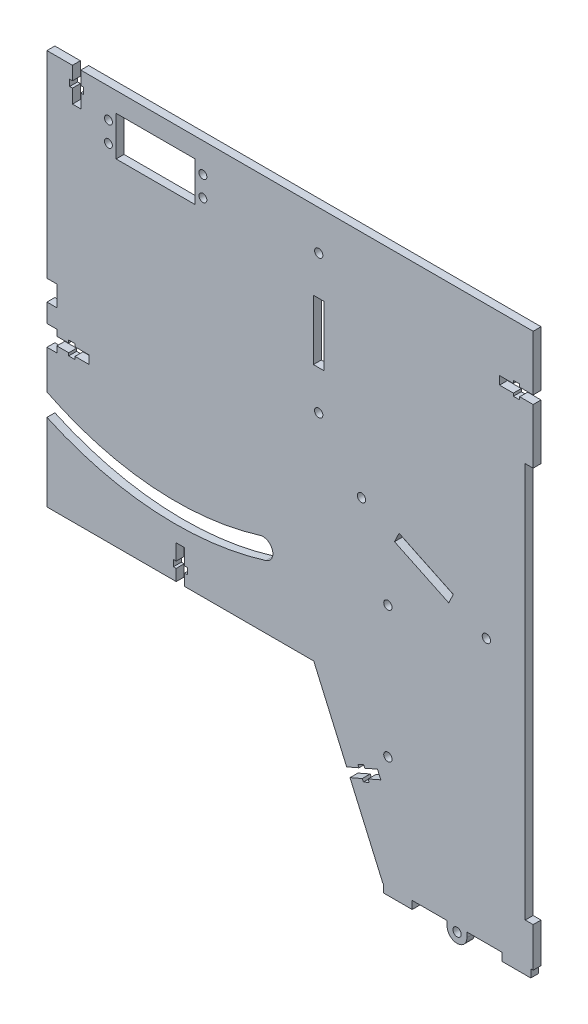
from build123d import *

# Parameters (mm, degrees)
BOSS_EXTRU_1_DEPTH       = 4
ENL_V_MAT_EXTRU_3_DEPTH  = 10
ESQUISSE3_R              = 2
ESQUISSE3_W              = 40
ESQUISSE3_H              = 20
ENL_V_MAT_EXTRU_4_DEPTH  = 242.33172191
ESQUISSE4_W              = 4
ESQUISSE4_H              = 200
ENL_V_MAT_EXTRU_5_DEPTH  = 242.33172191
ESQUISSE5_R              = 2.1
ENL_V_MAT_EXTRU_6_DEPTH  = 242.33172191
ESQUISSE8_W              = 5.4
ESQUISSE8_H              = 30.4
ENL_V_MAT_EXTRU_8_DEPTH  = 242.33172191
ESQUISSE10_W             = 4.4
ESQUISSE10_H             = 10.4
ENL_V_MAT_EXTRU_9_DEPTH  = 5
ESQUISSE12_R             = 2.1
BOSS_EXTRU_2_DEPTH       = 4
ESQUISSE14_W             = 14.6
ESQUISSE14_H             = 4
BOSS_EXTRU_3_DEPTH       = 4
ENL_V_MAT_EXTRU_11_DEPTH = 242.33172191
ENL_V_MAT_EXTRU_12_DEPTH = 242.33172191
ENL_V_MAT_EXTRU_13_DEPTH = 242.33172191
ENL_V_MAT_EXTRU_14_DEPTH = 242.33172191
ESQUISSE19_R             = 2.1
ENL_V_MAT_EXTRU_15_DEPTH = 242.33172191
ENL_V_MAT_EXTRU_16_DEPTH = 242.33172191


with BuildPart() as part:
    # Esquisse1 → Boss.-Extru.1 (new body)
    with BuildSketch(Plane.XY):
        Polygon((0, 0), (-135, 0), (-135, 200), (111, 200), (111, -80), (35, -80), align=None)
    extrude(amount=BOSS_EXTRU_1_DEPTH)

    # Esquisse2 → Enlèv. mat.-Extru.3 (cut)
    with BuildSketch(Plane(origin=(-100, 38, 4), x_dir=(-1, 0, 0), z_dir=(0, 0, -1))):
        with BuildLine():
            ThreePointArc((-75.787868531, -6.082649542), (-15.633697972, -12.332787722), (42.333333333, 4.912841999))
            ThreePointArc((42.333333333, 4.912841999), (44.422166387, 11.668341719), (37.666666667, 13.757174773))
            ThreePointArc((37.666666667, 13.757174773), (-16.560556167, -2.375833675), (-72.833812496, 3.471069783))
            ThreePointArc((-72.833812496, 3.471069783), (-79.087700176, 0.171238138), (-75.787868531, -6.082649542))
        make_face()
    extrude(amount=ENL_V_MAT_EXTRU_3_DEPTH, mode=Mode.SUBTRACT)

    # Esquisse3 → Enlèv. mat.-Extru.4 (cut, through all)
    with BuildSketch(Plane.XY.offset(4)):
        with Locations((-103.9, 185.1)):
            Circle(ESQUISSE3_R)
        with Locations((-103.9, 174.9)):
            Circle(ESQUISSE3_R)
        with Locations((-56.1, 185.1)):
            Circle(ESQUISSE3_R)
        with Locations((-56.1, 174.9)):
            Circle(ESQUISSE3_R)
        with Locations((-80, 180)):
            Rectangle(ESQUISSE3_W, ESQUISSE3_H)
    extrude(amount=-ENL_V_MAT_EXTRU_4_DEPTH, mode=Mode.SUBTRACT)

    # Esquisse4 → Enlèv. mat.-Extru.5 (cut, through all)
    with BuildSketch(Plane(origin=(0, 0, 0), x_dir=(-1, 0, 0), z_dir=(0, 0, -1))):
        with Locations((-109, 40)):
            Rectangle(ESQUISSE4_W, ESQUISSE4_H)
    extrude(amount=-ENL_V_MAT_EXTRU_5_DEPTH, mode=Mode.SUBTRACT)

    # Esquisse5 → Enlèv. mat.-Extru.6 (cut, through all)
    with BuildSketch(Plane(origin=(0, 0, 0), x_dir=(-1, 0, 0), z_dir=(0, 0, -1))):
        with Locations((-2.5, 180)):
            Circle(ESQUISSE5_R)
        with Locations((-2.5, 110)):
            Circle(ESQUISSE5_R)
        with Locations((-24.132044328, 83.658479689)):
            Circle(ESQUISSE5_R)
        with Locations((-87.332280645, 53.563129062)):
            Circle(ESQUISSE5_R)
    extrude(amount=-ENL_V_MAT_EXTRU_6_DEPTH, mode=Mode.SUBTRACT)

    # Esquisse8 → Enlèv. mat.-Extru.8 (cut, through all)
    with BuildSketch(Plane(origin=(0, 0, 0), x_dir=(-1, 0, 0), z_dir=(0, 0, -1))):
        Polygon((-40.847861933, 72.708071397), (-43.169503267, 77.583518198), (-70.616463039, 64.513537354), (-68.294821705, 59.638090553), align=None)
        with Locations((-2.5, 145)):
            Rectangle(ESQUISSE8_W, ESQUISSE8_H)
    extrude(amount=-ENL_V_MAT_EXTRU_8_DEPTH, mode=Mode.SUBTRACT)

    # Esquisse10 → Enlèv. mat.-Extru.9 (cut)
    with BuildSketch(Plane.ZY.offset(135)):
        with Locations((2, 95)):
            Rectangle(ESQUISSE10_W, ESQUISSE10_H)
        with Locations((2, 75.192593016)):
            Rectangle(ESQUISSE10_W, ESQUISSE10_H)
    extrude(amount=-ENL_V_MAT_EXTRU_9_DEPTH, mode=Mode.SUBTRACT)

    # Esquisse12 → Boss.-Extru.2 (add)
    with BuildSketch(Plane.XY.offset(4)):
        with BuildLine():
            Line((67.5, -80), (67.5, -82.5))
            ThreePointArc((67.5, -82.5), (72.5, -87.5), (77.5, -82.5))
            Line((77.5, -82.5), (77.5, -80))
            Line((77.5, -80), (67.5, -80))
        make_face()
        with Locations((72.5, -82.5)):
            Circle(ESQUISSE12_R, mode=Mode.SUBTRACT)
    extrude(amount=-BOSS_EXTRU_2_DEPTH)

    # Esquisse14 → Boss.-Extru.3 (add)
    with BuildSketch(Plane(origin=(0, 0, 0), x_dir=(-1, 0, 0), z_dir=(0, 0, -1))):
        with Locations((-102.5, -82)):
            Rectangle(ESQUISSE14_W, ESQUISSE14_H)
        with Locations((-42.5, -82)):
            Rectangle(ESQUISSE14_W, ESQUISSE14_H)
    extrude(amount=-BOSS_EXTRU_3_DEPTH)

    # Esquisse15 → Enlèv. mat.-Extru.11 (cut, through all)
    with BuildSketch(Plane(origin=(0, 0, 0), x_dir=(-1, 0, 0), z_dir=(0, 0, -1))):
        Polygon((-18.341719551, -41.923930403), (-16.658280449, -38.076069597), (-22.888150326, -35.350501525), (-22.327003958, -34.067881257), (-25.25870743, -32.785260988), (-25.819853798, -34.067881257), (-32.232955142, -31.262149418), (-33.916394245, -35.110010225), (-27.5032929, -37.915742063), (-28.064439268, -39.198362332), (-25.132735796, -40.480982601), (-24.571589429, -39.198362332), align=None)
    extrude(amount=-ENL_V_MAT_EXTRU_11_DEPTH, mode=Mode.SUBTRACT)

    # Esquisse16 → Enlèv. mat.-Extru.12 (cut, through all)
    with BuildSketch(Plane(origin=(0, 0, 0), x_dir=(-1, 0, 0), z_dir=(0, 0, -1))):
        Polygon((-111, 167.9), (-111, 172.1), (-104.2, 172.1), (-104.2, 173.5), (-101, 173.5), (-101, 172.1), (-94, 172.1), (-94, 167.9), (-101, 167.9), (-101, 166.5), (-104.2, 166.5), (-104.2, 167.9), align=None)
    extrude(amount=-ENL_V_MAT_EXTRU_12_DEPTH, mode=Mode.SUBTRACT)

    # Esquisse17 → Enlèv. mat.-Extru.13 (cut, through all)
    with BuildSketch(Plane(origin=(0, 0, 0), x_dir=(-1, 0, 0), z_dir=(0, 0, -1))):
        Polygon((69.6, 0), (65.4, 0), (65.4, 5.8), (64, 5.8), (64, 9), (65.4, 9), (65.4, 17), (69.6, 17), (69.6, 9), (71, 9), (71, 5.8), (69.6, 5.8), align=None)
    extrude(amount=-ENL_V_MAT_EXTRU_13_DEPTH, mode=Mode.SUBTRACT)

    # Esquisse18 → Enlèv. mat.-Extru.14 (cut, through all)
    with BuildSketch(Plane(origin=(0, 0, 0), x_dir=(-1, 0, 0), z_dir=(0, 0, -1))):
        Polygon((117.9, 200), (122.1, 200), (122.1, 193.2), (123.5, 193.2), (123.5, 190), (122.1, 190), (122.1, 183), (117.9, 183), (117.9, 190), (116.5, 190), (116.5, 193.2), (117.9, 193.2), align=None)
    extrude(amount=-ENL_V_MAT_EXTRU_14_DEPTH, mode=Mode.SUBTRACT)

    # Esquisse19 → Enlèv. mat.-Extru.15 (cut, through all)
    with BuildSketch(Plane.XY.offset(4)):
        with Locations((37.5, -23.25)):
            Circle(ESQUISSE19_R)
        with Locations((37.5, 43.25)):
            Circle(ESQUISSE19_R)
    extrude(amount=-ENL_V_MAT_EXTRU_15_DEPTH, mode=Mode.SUBTRACT)

    # Esquisse20 → Enlèv. mat.-Extru.16 (cut, through all)
    with BuildSketch(Plane(origin=(0, 0, 0), x_dir=(-1, 0, 0), z_dir=(0, 0, -1))):
        Polygon((130, 73.092593016), (130, 77.292593016), (124, 77.292593016), (124, 78.692593016), (120.8, 78.692593016), (120.8, 77.292593016), (113.8, 77.292593016), (113.8, 73.092593016), (120.8, 73.092593016), (120.8, 71.692593016), (124, 71.692593016), (124, 73.092593016), align=None)
    extrude(amount=-ENL_V_MAT_EXTRU_16_DEPTH, mode=Mode.SUBTRACT)


solid = part.part
